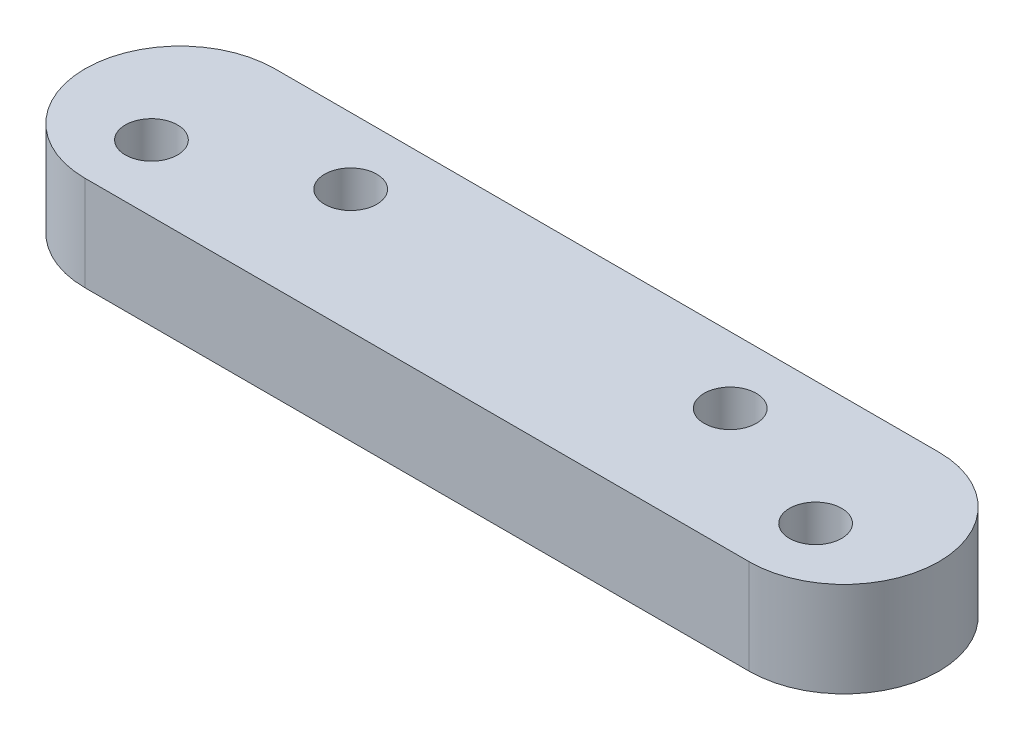
from build123d import *

# Parameters (mm, degrees)
SKETCH2_R           = 1.375
BOSS_EXTRUDE1_DEPTH = 5


with BuildPart() as part:
    # Sketch2 → Boss-Extrude1 (new body)
    with BuildSketch(Plane(origin=(0, 0, 0), x_dir=(1, 0, 0), z_dir=(0, 1, 0))):
        with BuildLine():
            Line((-17.5, 6.5), (17.5, 6.5))
            ThreePointArc((17.5, 6.5), (22.5, 1.5), (17.5, -3.5))
            Line((17.5, -3.5), (-17.5, -3.5))
            ThreePointArc((-17.5, -3.5), (-22.5, 1.5), (-17.5, 6.5))
        make_face()
        with Locations(Location((10, 3, 0), (0, 0, 270))):
            Circle(SKETCH2_R, mode=Mode.SUBTRACT)
        with Locations(Location((-10, 3, 0), (0, 0, 270))):
            Circle(SKETCH2_R, mode=Mode.SUBTRACT)
        with Locations(Location((-17.5, 0, 0), (0, 0, 270))):
            Circle(SKETCH2_R, mode=Mode.SUBTRACT)
        with Locations(Location((17.5, 0, 0), (0, 0, 270))):
            Circle(SKETCH2_R, mode=Mode.SUBTRACT)
    extrude(amount=BOSS_EXTRUDE1_DEPTH)


solid = part.part
